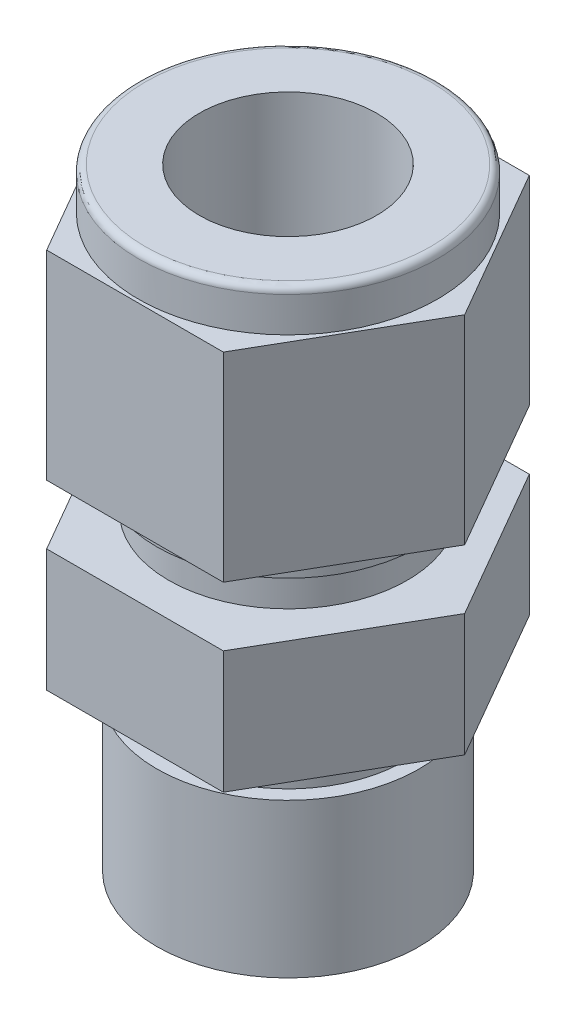
from build123d import *

# Parameters (mm, degrees)
SKETCH1_R           = 9.525
BOSS_EXTRUDE1_DEPTH = 11.176
SKETCH3_R           = 8.509
BOSS_EXTRUDE3_DEPTH = 2.54
BOSS_EXTRUDE4_DEPTH = 8.89
SKETCH5_R           = 8.6614
BOSS_EXTRUDE5_DEPTH = 2.54
SKETCH6_R           = 9.525
BOSS_EXTRUDE6_DEPTH = 1.778
BOSS_EXTRUDE7_DEPTH = 14.478
SKETCH8_R           = 10.8712
BOSS_EXTRUDE8_DEPTH = 3.048
FILLET1_R           = 0.508
SKETCH9_R           = 6.4389
CUT_EXTRUDE1_DEPTH  = 48.580882343


with BuildPart() as part:
    # Sketch1 → Boss-Extrude1 (new body)
    with BuildSketch(Plane(origin=(0, 0, 0), x_dir=(1, 0, 0), z_dir=(0, 1, 0))):
        with Locations(Location((0, 0, 0), (0, 0, 270))):
            Circle(SKETCH1_R)
    extrude(amount=BOSS_EXTRUDE1_DEPTH)

    # Sketch3 → Boss-Extrude3 (add)
    with BuildSketch(Plane(origin=(0, 11.176, 0), x_dir=(1, 0, 0), z_dir=(0, 1, 0))):
        with Locations(Location((0, 0, 0), (0, 0, 270))):
            Circle(SKETCH3_R)
    extrude(amount=BOSS_EXTRUDE3_DEPTH)

    # Sketch4 → Boss-Extrude4 (add)
    with BuildSketch(Plane(origin=(0, 13.716, 0), x_dir=(1, 0, 0), z_dir=(0, 1, 0))):
        Polygon((12.831609733, 0), (6.415804866, 11.1125), (-6.415804866, 11.1125), (-12.831609733, 0), (-6.415804866, -11.1125), (6.415804866, -11.1125), align=None)
    extrude(amount=BOSS_EXTRUDE4_DEPTH)

    # Sketch5 → Boss-Extrude5 (add)
    with BuildSketch(Plane(origin=(0, 22.606, 0), x_dir=(1, 0, 0), z_dir=(0, 1, 0))):
        with Locations(Location((0, 0, 0), (0, 0, 270))):
            Circle(SKETCH5_R)
    extrude(amount=BOSS_EXTRUDE5_DEPTH)

    # Sketch6 → Boss-Extrude6 (add)
    with BuildSketch(Plane(origin=(0, 25.146, 0), x_dir=(1, 0, 0), z_dir=(0, 1, 0))):
        with Locations(Location((0, 0, 0), (0, 0, 270))):
            Circle(SKETCH6_R)
    extrude(amount=BOSS_EXTRUDE6_DEPTH)

    # Sketch7 → Boss-Extrude7 (add)
    with BuildSketch(Plane(origin=(0, 26.924, 0), x_dir=(1, 0, 0), z_dir=(0, 1, 0))):
        Polygon((-6.415804866, -11.1125), (6.415804866, -11.1125), (12.831609733, 0), (6.415804866, 11.1125), (-6.415804866, 11.1125), (-12.831609733, 0), align=None)
    extrude(amount=BOSS_EXTRUDE7_DEPTH)

    # Sketch8 → Boss-Extrude8 (add)
    with BuildSketch(Plane(origin=(0, 41.402, 0), x_dir=(1, 0, 0), z_dir=(0, 1, 0))):
        with Locations(Location((0, 0, 0), (0, 0, 90))):
            Circle(SKETCH8_R)
    extrude(amount=BOSS_EXTRUDE8_DEPTH)

    # Fillet1
    fillet1_edges = [part.edges().sort_by_distance(p)[0] for p in [
        (0, 44.45, 10.8712),
    ]]
    fillet(fillet1_edges, radius=FILLET1_R)

    # Sketch9 → Cut-Extrude1 (cut, through all)
    with BuildSketch(Plane(origin=(0, 44.45, 0), x_dir=(1, 0, 0), z_dir=(0, 1, 0))):
        with Locations(Location((0, 0, 0), (0, 0, 270))):
            Circle(SKETCH9_R)
    extrude(amount=-CUT_EXTRUDE1_DEPTH, mode=Mode.SUBTRACT)


solid = part.part
